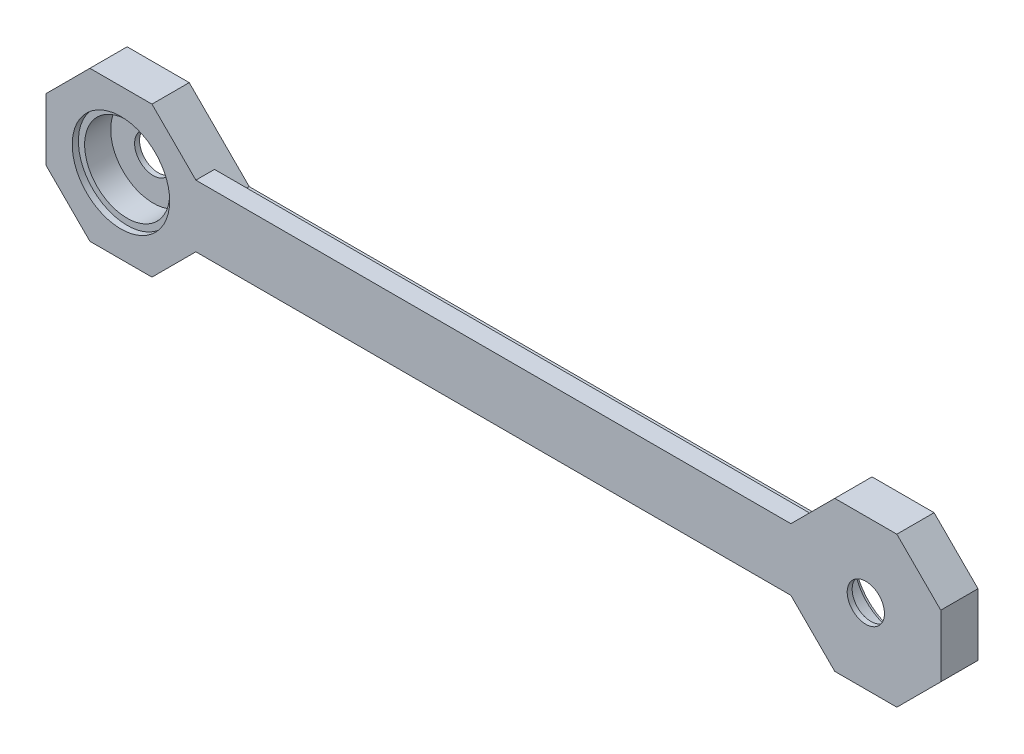
from build123d import *

# Parameters (mm, degrees)
SKETCH1_R           = 3
BOSS_EXTRUDE1_DEPTH = 6
BOSS_EXTRUDE2_DEPTH = 3
SKETCH3_R           = 6.85
CUT_EXTRUDE1_DEPTH  = 5.2
SKETCH4_R           = 7.85
CUT_EXTRUDE2_DEPTH  = 1
SKETCH5_R           = 6.85
CUT_EXTRUDE3_DEPTH  = 5.2
SKETCH6_R           = 7.85
CUT_EXTRUDE4_DEPTH  = 1


with BuildPart() as part:
    # Sketch1 → Boss-Extrude1 (new body)
    with BuildSketch(Plane.XY):
        Polygon((12.071067812, 5), (5, 12.071067812), (-5, 12.071067812), (-12.071067812, 5), (-14.676359397, 2.394708415), (-105.323640603, 2.394708415), (-107.928932188, 5), (-115, 12.071067812), (-125, 12.071067812), (-132.071067812, 5), (-132.071067812, -5), (-125, -12.071067812), (-115, -12.071067812), (-107.928932188, -5), (-105.323640603, -2.394708415), (-14.676359397, -2.394708415), (-12.071067812, -5), (-5, -12.071067812), (5, -12.071067812), (12.071067812, -5), align=None)
        with Locations((-120, 0)):
            Circle(SKETCH1_R, mode=Mode.SUBTRACT)
        Circle(SKETCH1_R, mode=Mode.SUBTRACT)
    extrude(amount=-BOSS_EXTRUDE1_DEPTH)

    # Sketch2 → Boss-Extrude2 (add)
    with BuildSketch(Plane.XY):
        Polygon((-14.676359397, -2.394708415), (-12.071067812, -5), (-107.928932188, -5), (-105.323640603, -2.394708415), align=None)
        Polygon((-14.676359397, 2.394708415), (-105.323640603, 2.394708415), (-107.928932188, 5), (-12.071067812, 5), align=None)
    extrude(amount=-BOSS_EXTRUDE2_DEPTH)

    # Sketch3 → Cut-Extrude1 (cut)
    with BuildSketch(Plane(origin=(0, 0, -6), x_dir=(-1, 0, 0), z_dir=(0, 0, -1))):
        Circle(SKETCH3_R)
    extrude(amount=-CUT_EXTRUDE1_DEPTH, mode=Mode.SUBTRACT)

    # Sketch4 → Cut-Extrude2 (cut)
    with BuildSketch(Plane(origin=(0, 0, -6), x_dir=(-1, 0, 0), z_dir=(0, 0, -1))):
        Circle(SKETCH4_R)
    extrude(amount=-CUT_EXTRUDE2_DEPTH, mode=Mode.SUBTRACT)

    # Sketch5 → Cut-Extrude3 (cut)
    with BuildSketch(Plane.XY):
        with Locations((-120, 0)):
            Circle(SKETCH5_R)
    extrude(amount=-CUT_EXTRUDE3_DEPTH, mode=Mode.SUBTRACT)

    # Sketch6 → Cut-Extrude4 (cut)
    with BuildSketch(Plane.XY):
        with Locations((-120, 0)):
            Circle(SKETCH6_R)
    extrude(amount=-CUT_EXTRUDE4_DEPTH, mode=Mode.SUBTRACT)


solid = part.part
